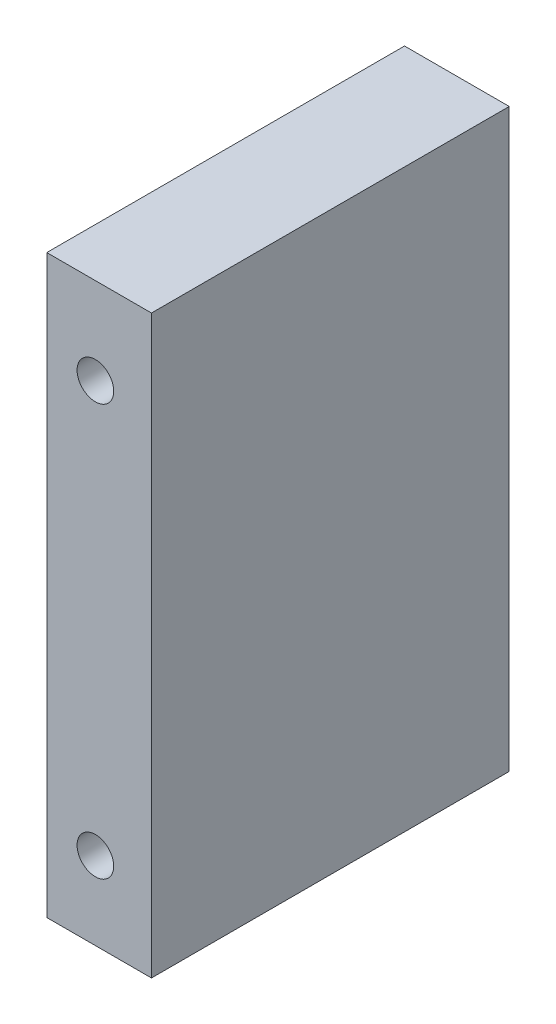
from build123d import *

# Parameters (mm, degrees)
SZKIC1_W                       = 12
SZKIC1_H                       = 66
DODANIE_WYCI_GNI_CIE1_DEPTH    = 41
OTW_R_GWINTOWANY_M5X0_81_D     = 4.2
OTW_R_GWINTOWANY_M5X0_81_DEPTH = 25
OTW_R_GWINTOWANY_M5X0_81_TIP   = 1.2618073
OTW_R_GWINTOWANY_M5X0_82_D     = 4.2
OTW_R_GWINTOWANY_M5X0_82_DEPTH = 25
OTW_R_GWINTOWANY_M5X0_82_TIP   = 1.2618073


with BuildPart() as part:
    # Szkic1 → Dodanie-wyciągnięcie1 (new body)
    with BuildSketch(Plane.XY):
        with Locations((-46, -22)):
            Rectangle(SZKIC1_W, SZKIC1_H)
    extrude(amount=DODANIE_WYCI_GNI_CIE1_DEPTH)

    # Otwór gwintowany M5x0.81
    with Locations(Plane(origin=(0, 0, 0), x_dir=(-1, 0, 0), z_dir=(0, 0, -1))):
        with Locations((46, -39), (46, -5)):
            Hole(OTW_R_GWINTOWANY_M5X0_81_D / 2, depth=OTW_R_GWINTOWANY_M5X0_81_DEPTH)
            with Locations((0, 0, -(OTW_R_GWINTOWANY_M5X0_81_DEPTH + OTW_R_GWINTOWANY_M5X0_81_TIP / 2))):  # 118° drill point
                Cone(0, OTW_R_GWINTOWANY_M5X0_81_D / 2, OTW_R_GWINTOWANY_M5X0_81_TIP, mode=Mode.SUBTRACT)

    # Otwór gwintowany M5x0.82
    with Locations(Plane.XY.offset(41)):
        with Locations((-46.43, -46.07), (-46.43, 1.07)):
            Hole(OTW_R_GWINTOWANY_M5X0_82_D / 2, depth=OTW_R_GWINTOWANY_M5X0_82_DEPTH)
            with Locations((0, 0, -(OTW_R_GWINTOWANY_M5X0_82_DEPTH + OTW_R_GWINTOWANY_M5X0_82_TIP / 2))):  # 118° drill point
                Cone(0, OTW_R_GWINTOWANY_M5X0_82_D / 2, OTW_R_GWINTOWANY_M5X0_82_TIP, mode=Mode.SUBTRACT)


solid = part.part
